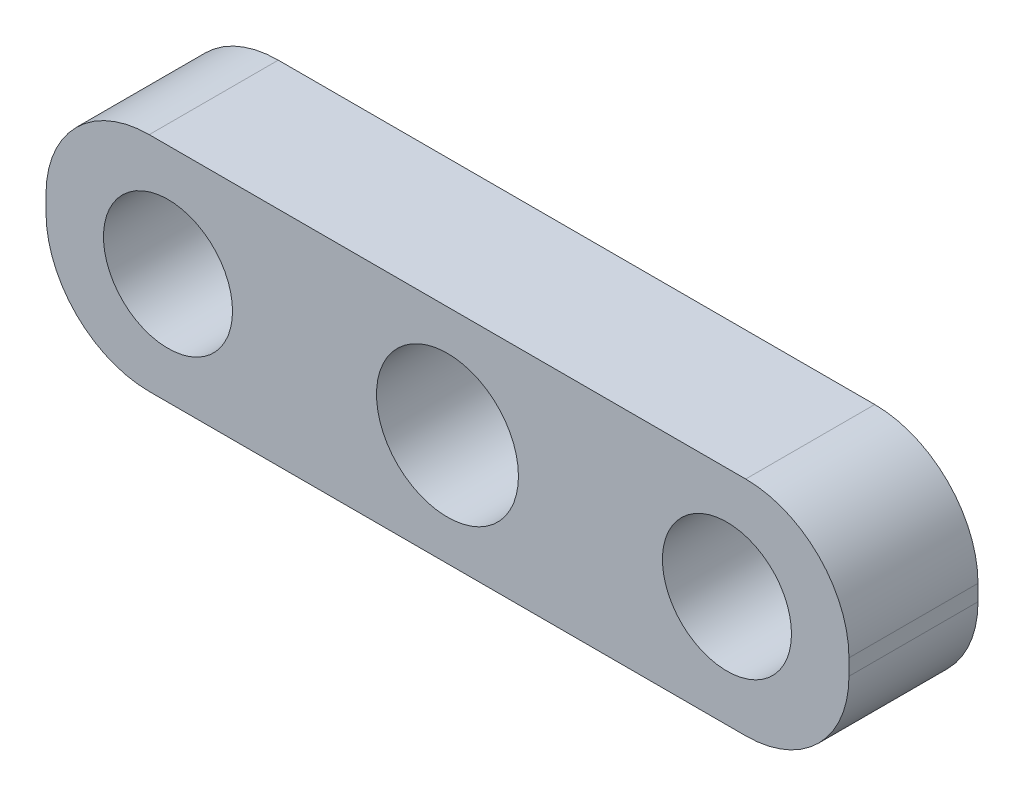
from build123d import *

# Parameters (mm, degrees)
SKETCH1_W           = 15.555334961
SKETCH1_H           = 8.618657178
SKETCH1_R           = 2.5
BOSS_EXTRUDE1_DEPTH = 5
SKETCH2_R           = 2.75
CUT_EXTRUDE1_DEPTH  = 22.76046651
FILLET1_R           = 4


with BuildPart() as part:
    # Sketch1 → Boss-Extrude1 (new body)
    # profile 1 of 2: a face of its own
    with BuildSketch(Plane.XY):
        with Locations((-7.777667481, 10.0625)):
            Rectangle(SKETCH1_W, SKETCH1_H)
        with Locations((-10.828492502, 10.0625)):
            Circle(SKETCH1_R, mode=Mode.SUBTRACT)
    # profile 2 of 2: a face of its own
    with BuildSketch(Plane.XY):
        with Locations((7.777667481, 10.0625)):
            Rectangle(SKETCH1_W, SKETCH1_H)
        with Locations((10.828492502, 10.0625)):
            Circle(SKETCH1_R, mode=Mode.SUBTRACT)
    extrude(amount=BOSS_EXTRUDE1_DEPTH)

    # Sketch2 → Cut-Extrude1 (cut, through all)
    with BuildSketch(Plane.XY.offset(5)):
        with Locations((0, 10.0625)):
            Circle(SKETCH2_R)
    extrude(amount=-CUT_EXTRUDE1_DEPTH, mode=Mode.SUBTRACT)

    # Fillet1
    fillet1_edges = [part.edges().sort_by_distance(p)[0] for p in [
        (15.555334961, 14.371828589, 2.5),
        (15.555334961, 5.753171411, 2.5),
        (-15.555334961, 5.753171411, 2.5),
        (-15.555334961, 14.371828589, 2.5),
    ]]
    fillet(fillet1_edges, radius=FILLET1_R)


solid = part.part
